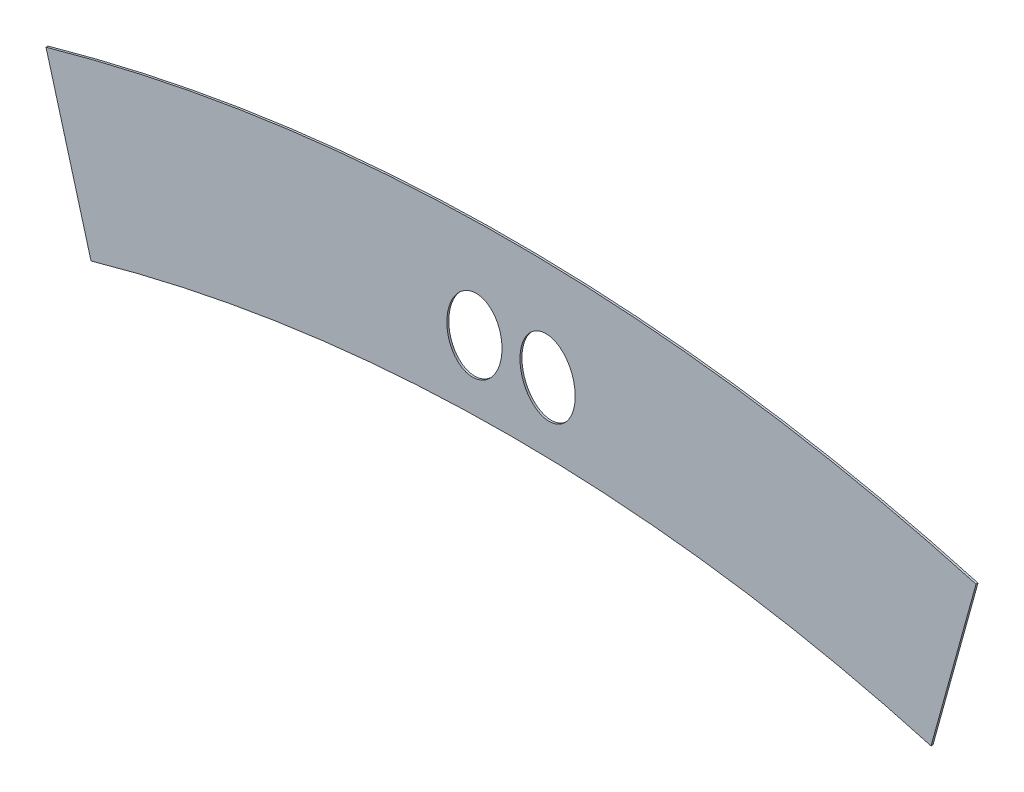
from build123d import *

# Parameters (mm, degrees)
SKETCH1_RX         = 60.325
SKETCH1_RY         = 44.45
BASE_EXTRUDE_DEPTH = 3.175


with BuildPart() as part:
    # Sketch1 → Base-Extrude (new body)
    with BuildSketch(Plane.XY):
        with BuildLine():
            Line((-752.475, -104.363036769), (-679.6278, -367.521079599))
            ThreePointArc((-679.6278, -367.521079599), (0, -273.05), (679.6278, -367.521079599))
            Line((679.6278, -367.521079599), (752.475, -104.363036769))
            ThreePointArc((752.475, -104.363036769), (0, 0), (-752.475, -104.363036769))
        make_face()
        with Locations(Location((-59.197924106, -161.431165366), (0, 0, -95.79))):
            Ellipse(SKETCH1_RX, SKETCH1_RY, mode=Mode.SUBTRACT)
        with Locations(Location((59.197924106, -161.431165366), (0, 0, -84.21))):
            Ellipse(SKETCH1_RX, SKETCH1_RY, mode=Mode.SUBTRACT)
    extrude(amount=-BASE_EXTRUDE_DEPTH)


solid = part.part
